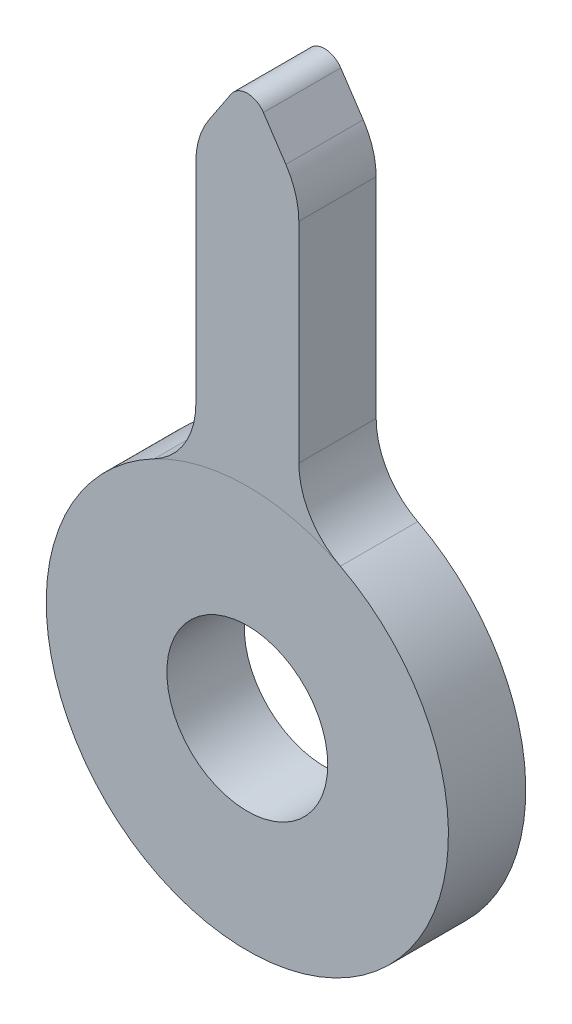
from build123d import *

# Parameters (mm, degrees)
SKETCH1_R           = 1.651
BOSS_EXTRUDE1_DEPTH = 1.5875
FILLET1_R           = 1.5875
FILLET2_R           = 0.396875
FILLET3_R           = 1.5875


with BuildPart() as part:
    # Sketch1 → Boss-Extrude1 (new body)
    with BuildSketch(Plane.XY):
        with BuildLine():
            Line((1.05664, 3.989958416), (1.05664, 9.8425))
            Line((1.05664, 9.8425), (0, 11.43))
            Line((0, 11.43), (-1.05664, 9.8425))
            Line((-1.05664, 9.8425), (-1.05664, 3.989958416))
            ThreePointArc((-1.05664, 3.989958416), (0, -4.1275), (1.05664, 3.989958416))
        make_face()
        Circle(SKETCH1_R, mode=Mode.SUBTRACT)
    extrude(amount=BOSS_EXTRUDE1_DEPTH)

    # Fillet1
    fillet1_edges = [part.edges().sort_by_distance(p)[0] for p in [
        (1.05664, 9.8425, 0.79375),
        (-1.05664, 9.8425, 0.79375),
    ]]
    fillet(fillet1_edges, radius=FILLET1_R)

    # Fillet2
    fillet2_edges = [part.edges().sort_by_distance(p)[0] for p in [
        (0, 11.43, 0.79375),
    ]]
    fillet(fillet2_edges, radius=FILLET2_R)

    # Fillet3
    fillet3_edges = [part.edges().sort_by_distance(p)[0] for p in [
        (1.05664, 3.989958416, 0.79375),
        (-1.05664, 3.989958416, 0.79375),
    ]]
    fillet(fillet3_edges, radius=FILLET3_R)


solid = part.part
